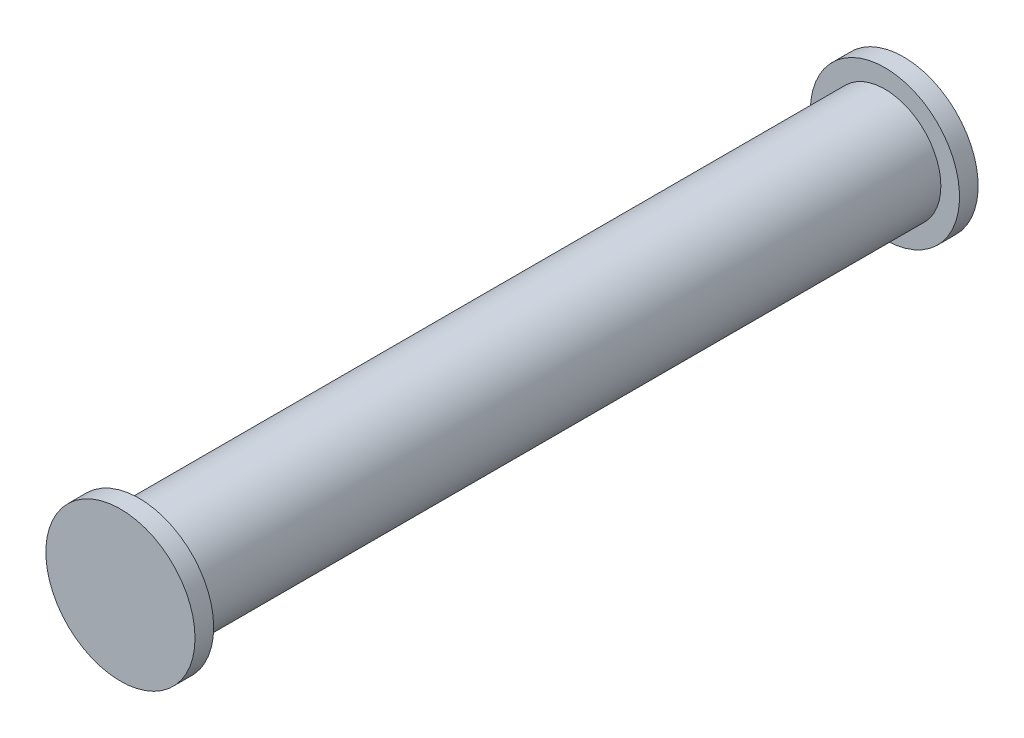
from build123d import *

# Parameters (mm, degrees)
SKETCH1_R           = 19.05
BOSS_EXTRUDE1_DEPTH = 254
SKETCH2_R           = 25.4
BOSS_EXTRUDE2_DEPTH = 6.35
BOSS_EXTRUDE3_START = 6.35
SKETCH3_R           = 25.4
BOSS_EXTRUDE3_DEPTH = 6.35


with BuildPart() as part:
    # Sketch1 → Boss-Extrude1 (new body)
    with BuildSketch(Plane.XY):
        Circle(SKETCH1_R)
    extrude(amount=BOSS_EXTRUDE1_DEPTH)

    # Sketch2 → Boss-Extrude2 (add)
    with BuildSketch(Plane.XY.offset(254)):
        Circle(SKETCH2_R)
    extrude(amount=BOSS_EXTRUDE2_DEPTH)

    # Sketch3 → Boss-Extrude3 (add)
    with BuildSketch(Plane(origin=(0, 0, 0), x_dir=(-1, 0, 0), z_dir=(0, 0, -1)).offset(BOSS_EXTRUDE3_START)):
        with Locations(Location((0, 0, 0), (0, 0, 180))):
            Circle(SKETCH3_R)
    extrude(amount=-BOSS_EXTRUDE3_DEPTH)


solid = part.part
